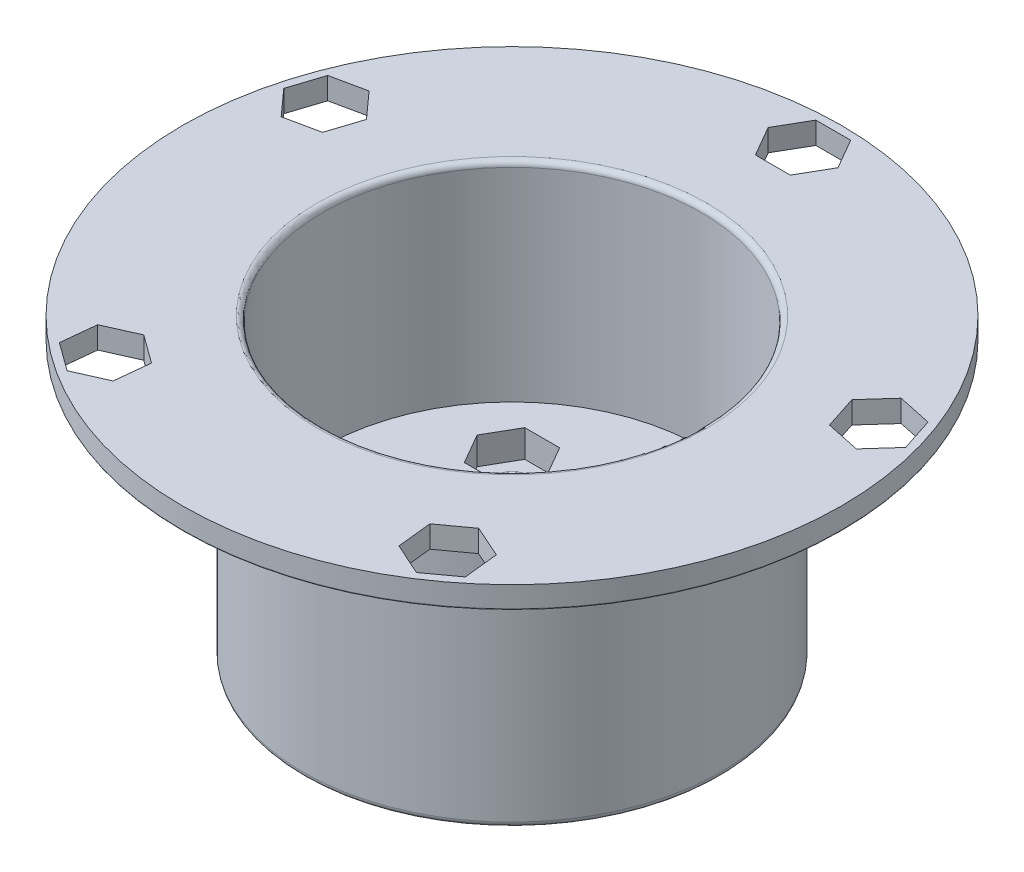
from build123d import *

# Parameters (mm, degrees)
SKETCH_1_R          = 19
SKETCH_1_R_2        = 1.25
EXTRUDE_1_DEPTH     = 8
SKETCH_2_R          = 19
SKETCH_2_R_2        = 17
EXTRUDE_2_DEPTH     = 19
SKETCH_3_R          = 30
SKETCH_3_R_2        = 19
EXTRUDE_3_DEPTH     = 2
CUT_EXTRUDE_1_REACH = 48.487
SKETCH_4_R          = 5.2
SKETCH_5_R          = 2.1
CUT_EXTRUDE_2_DEPTH = 6.2
CUT_EXTRUDE_3_REACH = 52.289
SKETCH_6_R          = 1.6
CUT_EXTRUDE_4_DEPTH = 2.5
SKETCH_9_W          = 23
SKETCH_9_H          = 23
CUT_EXTRUDE_5_DEPTH = 1.6
FILLET_1_R          = 4
CUT_EXTRUDE_6_DEPTH = 1.6
SKETCH_11_R         = 17.25
CUT_EXTRUDE_7_DEPTH = 19
CUT_EXTRUDE_8_REACH = 52.289
SKETCH_12_R         = 1.5
CUT_EXTRUDE_9_DEPTH = 2
FILLET_2_R          = 0.5
FILLET_3_R          = 0.5
FILLET_4_R          = 0.25
FILLET_5_R          = 0.1
FILLET_6_R          = 0.1


with BuildPart() as part:
    # 草图1 → 凸台-拉伸1 (new body)
    with BuildSketch(Plane(origin=(0, 0, 0), x_dir=(1, 0, 0), z_dir=(0, 1, 0))):
        with Locations(Location((0, 0, 0), (0, 0, 270))):
            Circle(SKETCH_1_R)
        with Locations(Location((0, 8, 0), (0, 0, 270))):
            Circle(SKETCH_1_R_2, mode=Mode.SUBTRACT)
        with Locations(Location((8, 0, 0), (0, 0, 270))):
            Circle(SKETCH_1_R_2, mode=Mode.SUBTRACT)
        with Locations(Location((0, -8, 0), (0, 0, 270))):
            Circle(SKETCH_1_R_2, mode=Mode.SUBTRACT)
        with Locations(Location((-8, 0, 0), (0, 0, 270))):
            Circle(SKETCH_1_R_2, mode=Mode.SUBTRACT)
    extrude(amount=EXTRUDE_1_DEPTH)

    # 草图2 → 凸台-拉伸2 (add)
    with BuildSketch(Plane(origin=(0, 8, 0), x_dir=(1, 0, 0), z_dir=(0, 1, 0))):
        with Locations(Location((0, 0, 0), (0, 0, 270))):
            Circle(SKETCH_2_R)
        with Locations(Location((0, 0, 0), (0, 0, 270))):
            Circle(SKETCH_2_R_2, mode=Mode.SUBTRACT)
    extrude(amount=EXTRUDE_2_DEPTH)


with BuildPart() as body_2:
    # 草图3 → 凸台-拉伸3 (new body)
    with BuildSketch(Plane(origin=(0, 27, 0), x_dir=(1, 0, 0), z_dir=(0, 1, 0))):
        with Locations(Location((0, 0, 0), (0, 0, 270))):
            Circle(SKETCH_3_R)
        with Locations(Location((0, 0, 0), (0, 0, 270))):
            Circle(SKETCH_3_R_2, mode=Mode.SUBTRACT)
    extrude(amount=-EXTRUDE_3_DEPTH)

    # Combine 1: union part
    add(part.part)

    # 草图4 → 切除-拉伸1 (cut, up to next)
    with BuildSketch(Plane(origin=(0, 8, 0), x_dir=(1, 0, 0), z_dir=(0, 1, 0)), mode=Mode.PRIVATE) as cut_extrude_1_sk1:
        with Locations(Location((0, 0, 0), (0, 0, 270))):
            Circle(SKETCH_4_R)
    cut_extrude_1_tool1 = extrude(cut_extrude_1_sk1.sketch, amount=-CUT_EXTRUDE_1_REACH, mode=Mode.PRIVATE) & body_2.part
    add(cut_extrude_1_tool1.solids().sort_by_distance((0, 8, 0))[0], mode=Mode.SUBTRACT)

    # 草图5 → 切除-拉伸2 (cut)
    with BuildSketch(Plane.XZ):
        with Locations(Location((0, 8, 0), (0, 0, 270))):
            Circle(SKETCH_5_R)
        with Locations(Location((8, 0, 0), (0, 0, 270))):
            Circle(SKETCH_5_R)
        with Locations(Location((0, -8, 0), (0, 0, 270))):
            Circle(SKETCH_5_R)
        with Locations(Location((-8, 0, 0), (0, 0, 270))):
            Circle(SKETCH_5_R)
    extrude(amount=-CUT_EXTRUDE_2_DEPTH, mode=Mode.SUBTRACT)

    # 草图6 → 切除-拉伸3 (cut, up to next)
    with BuildSketch(Plane.XZ, mode=Mode.PRIVATE) as cut_extrude_3_sk1:
        with Locations(Location((-8, 8, 0), (0, 0, 270))):
            Circle(SKETCH_6_R)
    cut_extrude_3_tool1 = extrude(cut_extrude_3_sk1.sketch, amount=-CUT_EXTRUDE_3_REACH, mode=Mode.PRIVATE) & body_2.part
    # 草图6 → 切除-拉伸3 (cut, up to next)
    with BuildSketch(Plane.XZ, mode=Mode.PRIVATE) as cut_extrude_3_sk2:
        with Locations(Location((8, 8, 0), (0, 0, 270))):
            Circle(SKETCH_6_R)
    cut_extrude_3_tool2 = extrude(cut_extrude_3_sk2.sketch, amount=-CUT_EXTRUDE_3_REACH, mode=Mode.PRIVATE) & body_2.part
    # 草图6 → 切除-拉伸3 (cut, up to next)
    with BuildSketch(Plane.XZ, mode=Mode.PRIVATE) as cut_extrude_3_sk3:
        with Locations(Location((8, -8, 0), (0, 0, 270))):
            Circle(SKETCH_6_R)
    cut_extrude_3_tool3 = extrude(cut_extrude_3_sk3.sketch, amount=-CUT_EXTRUDE_3_REACH, mode=Mode.PRIVATE) & body_2.part
    # 草图6 → 切除-拉伸3 (cut, up to next)
    with BuildSketch(Plane.XZ, mode=Mode.PRIVATE) as cut_extrude_3_sk4:
        with Locations(Location((-8, -8, 0), (0, 0, 270))):
            Circle(SKETCH_6_R)
    cut_extrude_3_tool4 = extrude(cut_extrude_3_sk4.sketch, amount=-CUT_EXTRUDE_3_REACH, mode=Mode.PRIVATE) & body_2.part
    add(cut_extrude_3_tool1.solids().sort_by_distance((-8, 0, 8))[0], mode=Mode.SUBTRACT)
    add(cut_extrude_3_tool2.solids().sort_by_distance((8, 0, 8))[0], mode=Mode.SUBTRACT)
    add(cut_extrude_3_tool3.solids().sort_by_distance((8, 0, -8))[0], mode=Mode.SUBTRACT)
    add(cut_extrude_3_tool4.solids().sort_by_distance((-8, 0, -8))[0], mode=Mode.SUBTRACT)

    # 草图7 → 切除-拉伸4 (cut)
    with BuildSketch(Plane(origin=(0, 8, 0), x_dir=(1, 0, 0), z_dir=(0, 1, 0))):
        Polygon((-6.41228676, 10.75), (-9.58771324, 10.75), (-11.175426481, 8), (-9.58771324, 5.25), (-6.41228676, 5.25), (-4.824573519, 8), align=None)
        Polygon((4.824573519, 8), (6.41228676, 10.75), (9.58771324, 10.75), (11.175426481, 8), (9.58771324, 5.25), (6.41228676, 5.25), align=None)
        Polygon((-4.824573519, -8), (-6.41228676, -10.75), (-9.58771324, -10.75), (-11.175426481, -8), (-9.58771324, -5.25), (-6.41228676, -5.25), align=None)
        Polygon((6.41228676, -5.25), (4.824573519, -8), (6.41228676, -10.75), (9.58771324, -10.75), (11.175426481, -8), (9.58771324, -5.25), align=None)
    extrude(amount=-CUT_EXTRUDE_4_DEPTH, mode=Mode.SUBTRACT)

    # 草图9 → 切除-拉伸5 (cut)
    with BuildSketch(Plane.XZ):
        Rectangle(SKETCH_9_W, SKETCH_9_H)
    extrude(amount=-CUT_EXTRUDE_5_DEPTH, mode=Mode.SUBTRACT)

    # 圆角1
    fillet_1_edges = [body_2.edges().sort_by_distance(p)[0] for p in [
        (11.5, 0.8, 11.5),
        (11.5, 0.8, -11.5),
        (-11.5, 0.8, -11.5),
        (-11.5, 0.8, 11.5),
    ]]
    fillet(fillet_1_edges, radius=FILLET_1_R)

    # 草图10 → 切除-拉伸6 (cut)
    with BuildSketch(Plane.XZ.offset(-1.6)):
        with BuildLine():
            Line((10.5, -7.5), (10.5, 7.5))
            ThreePointArc((10.5, 7.5), (9.621320344, 9.621320344), (7.5, 10.5))
            Line((7.5, 10.5), (-7.5, 10.5))
            ThreePointArc((-7.5, 10.5), (-9.621320344, 9.621320344), (-10.5, 7.5))
            Line((-10.5, 7.5), (-10.5, -7.5))
            ThreePointArc((-10.5, -7.5), (-9.621320344, -9.621320344), (-7.5, -10.5))
            Line((-7.5, -10.5), (7.5, -10.5))
            ThreePointArc((7.5, -10.5), (9.621320344, -9.621320344), (10.5, -7.5))
        make_face()
    extrude(amount=-CUT_EXTRUDE_6_DEPTH, mode=Mode.SUBTRACT)

    # 草图11 → 切除-拉伸7 (cut)
    with BuildSketch(Plane(origin=(0, 27, 0), x_dir=(1, 0, 0), z_dir=(0, 1, 0))):
        with Locations(Location((0, 0, 0), (0, 0, 270))):
            Circle(SKETCH_11_R)
    extrude(amount=-CUT_EXTRUDE_7_DEPTH, mode=Mode.SUBTRACT)

    # 草图12 → 切除-拉伸8 (cut, up to next)
    with BuildSketch(Plane(origin=(0, 27, 0), x_dir=(1, 0, 0), z_dir=(0, 1, 0)), mode=Mode.PRIVATE) as cut_extrude_8_sk1:
        with Locations(Location((0, 26.5, 0), (0, 0, 270))):
            Circle(SKETCH_12_R)
    cut_extrude_8_tool1 = extrude(cut_extrude_8_sk1.sketch, amount=-CUT_EXTRUDE_8_REACH, mode=Mode.PRIVATE) & body_2.part
    # 草图12 → 切除-拉伸8 (cut, up to next)
    with BuildSketch(Plane(origin=(0, 27, 0), x_dir=(1, 0, 0), z_dir=(0, 1, 0)), mode=Mode.PRIVATE) as cut_extrude_8_sk2:
        with Locations(Location((25.202997682, 8.188950351, 0), (0, 0, 270))):
            Circle(SKETCH_12_R)
    cut_extrude_8_tool2 = extrude(cut_extrude_8_sk2.sketch, amount=-CUT_EXTRUDE_8_REACH, mode=Mode.PRIVATE) & body_2.part
    # 草图12 → 切除-拉伸8 (cut, up to next)
    with BuildSketch(Plane(origin=(0, 27, 0), x_dir=(1, 0, 0), z_dir=(0, 1, 0)), mode=Mode.PRIVATE) as cut_extrude_8_sk3:
        with Locations(Location((15.576309186, -21.438950351, 0), (0, 0, 270))):
            Circle(SKETCH_12_R)
    cut_extrude_8_tool3 = extrude(cut_extrude_8_sk3.sketch, amount=-CUT_EXTRUDE_8_REACH, mode=Mode.PRIVATE) & body_2.part
    # 草图12 → 切除-拉伸8 (cut, up to next)
    with BuildSketch(Plane(origin=(0, 27, 0), x_dir=(1, 0, 0), z_dir=(0, 1, 0)), mode=Mode.PRIVATE) as cut_extrude_8_sk4:
        with Locations(Location((-15.576309186, -21.438950351, 0), (0, 0, 270))):
            Circle(SKETCH_12_R)
    cut_extrude_8_tool4 = extrude(cut_extrude_8_sk4.sketch, amount=-CUT_EXTRUDE_8_REACH, mode=Mode.PRIVATE) & body_2.part
    # 草图12 → 切除-拉伸8 (cut, up to next)
    with BuildSketch(Plane(origin=(0, 27, 0), x_dir=(1, 0, 0), z_dir=(0, 1, 0)), mode=Mode.PRIVATE) as cut_extrude_8_sk5:
        with Locations(Location((-25.202997682, 8.188950351, 0), (0, 0, 270))):
            Circle(SKETCH_12_R)
    cut_extrude_8_tool5 = extrude(cut_extrude_8_sk5.sketch, amount=-CUT_EXTRUDE_8_REACH, mode=Mode.PRIVATE) & body_2.part
    add(cut_extrude_8_tool1.solids().sort_by_distance((0, 27, -26.5))[0], mode=Mode.SUBTRACT)
    add(cut_extrude_8_tool2.solids().sort_by_distance((25.202998, 27, -8.18895))[0], mode=Mode.SUBTRACT)
    add(cut_extrude_8_tool3.solids().sort_by_distance((15.576309, 27, 21.43895))[0], mode=Mode.SUBTRACT)
    add(cut_extrude_8_tool4.solids().sort_by_distance((-15.576309, 27, 21.43895))[0], mode=Mode.SUBTRACT)
    add(cut_extrude_8_tool5.solids().sort_by_distance((-25.202998, 27, -8.18895))[0], mode=Mode.SUBTRACT)

    # 草图14 → 切除-拉伸9 (cut)
    with BuildSketch(Plane.XZ.offset(-25)):
        Polygon((-22.096961889, -8.84915864), (-23.078222635, -5.829148593), (-26.184258429, -5.168940305), (-28.309033475, -7.528742062), (-27.327772728, -10.548752109), (-24.221736935, -11.208960397), align=None)
        Polygon((1.58771324, -23.75), (-1.58771324, -23.75), (-3.175426481, -26.5), (-1.58771324, -29.25), (1.58771324, -29.25), (3.175426481, -26.5), align=None)
        Polygon((-15.244386736, 18.280919189), (-12.675412748, 20.147388044), (-13.007335199, 23.305419206), (-15.908231636, 24.596981513), (-18.477205623, 22.730512658), (-18.145283173, 19.572481496), align=None)
        Polygon((12.675412748, 20.147388044), (15.244386736, 18.280919189), (18.145283173, 19.572481496), (18.477205623, 22.730512658), (15.908231636, 24.596981513), (13.007335199, 23.305419206), align=None)
        Polygon((23.078222635, -5.829148593), (22.096961889, -8.84915864), (24.221736935, -11.208960397), (27.327772728, -10.548752109), (28.309033475, -7.528742062), (26.184258429, -5.168940305), align=None)
    extrude(amount=-CUT_EXTRUDE_9_DEPTH, mode=Mode.SUBTRACT)

    # 圆角2
    fillet_2_edges = [body_2.edges().sort_by_distance(p)[0] for p in [
        (0, 27, -17.25),
    ]]
    fillet(fillet_2_edges, radius=FILLET_2_R)

    # 圆角3
    fillet_3_edges = [body_2.edges().sort_by_distance(p)[0] for p in [
        (0, 0, -19),
    ]]
    fillet(fillet_3_edges, radius=FILLET_3_R)

    # 圆角4
    fillet_4_edges = [body_2.edges().sort_by_distance(p)[0] for p in [
        (0, 3.2, -5.2),
        (0, 8, -5.2),
    ]]
    fillet(fillet_4_edges, radius=FILLET_4_R)

    # 圆角5
    fillet_5_edges = [body_2.edges().sort_by_distance(p)[0] for p in [
        (-8, 5.5, 9.6),
        (8, 5.5, 9.6),
        (0, 8, -9.25),
        (8, 8, -1.25),
        (0, 8, 6.75),
        (-8, 5.5, -6.4),
        (-8, 8, -1.25),
        (8, 3.2, 9.6),
        (-8, 3.2, -6.4),
        (-8, 3.2, 2.1),
        (0, 3.2, 10.1),
        (0, 3.2, -5.9),
        (-8, 3.2, 9.6),
        (8, 3.2, -6.4),
        (0, 6.2, 6.75),
        (8, 6.2, -1.25),
        (0, 6.2, -9.25),
        (-8, 6.2, -1.25),
        (8, 5.5, -6.4),
    ]]
    fillet(fillet_5_edges, radius=FILLET_5_R)

    # 圆角6
    fillet_6_edges = [body_2.edges().sort_by_distance(p)[0] for p in [
        (0, 25, -30),
    ]]
    fillet(fillet_6_edges, radius=FILLET_6_R)


solid = body_2.part
